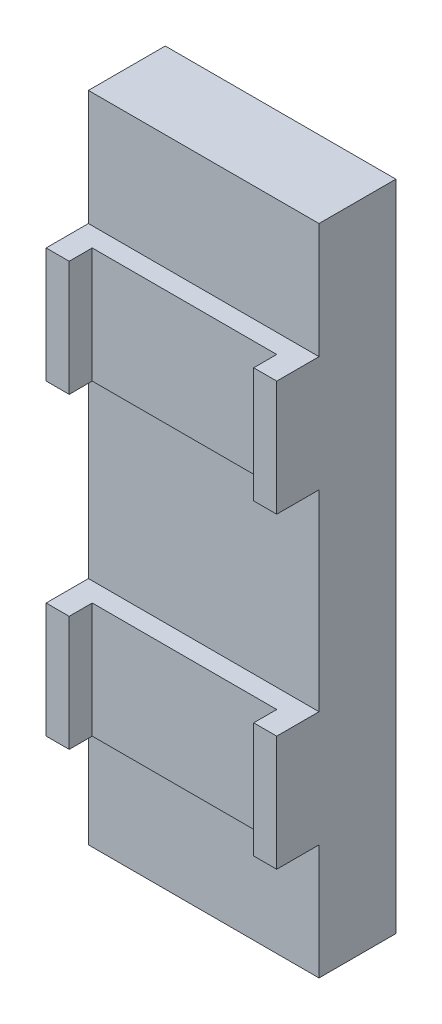
from build123d import *

# Parameters (mm, degrees)
SKETCH1_W           = 30
SKETCH1_H           = 85
BOSS_EXTRUDE1_DEPTH = 10
SKETCH2_W           = 30
SKETCH2_H           = 15
BOSS_EXTRUDE2_DEPTH = 2.5
SKETCH3_W           = 3
SKETCH3_H           = 15
BOSS_EXTRUDE3_DEPTH = 3


with BuildPart() as part:
    # Sketch1 → Boss-Extrude1 (new body)
    with BuildSketch(Plane.XY):
        with Locations((15, 42.5)):
            Rectangle(SKETCH1_W, SKETCH1_H)
    extrude(amount=BOSS_EXTRUDE1_DEPTH)

    # Sketch2 → Boss-Extrude2 (add)
    with BuildSketch(Plane.XY.offset(10)):
        with Locations((15, 62.5)):
            Rectangle(SKETCH2_W, SKETCH2_H)
        with Locations((15, 22.5)):
            Rectangle(SKETCH2_W, SKETCH2_H)
    extrude(amount=BOSS_EXTRUDE2_DEPTH)

    # Sketch3 → Boss-Extrude3 (add)
    with BuildSketch(Plane.XY.offset(12.5)):
        with Locations((28.5, 62.5)):
            Rectangle(SKETCH3_W, SKETCH3_H)
        with Locations((28.5, 22.5)):
            Rectangle(SKETCH3_W, SKETCH3_H)
        with Locations((1.5, 22.5)):
            Rectangle(SKETCH3_W, SKETCH3_H)
        with Locations((1.5, 62.5)):
            Rectangle(SKETCH3_W, SKETCH3_H)
    extrude(amount=BOSS_EXTRUDE3_DEPTH)


solid = part.part
